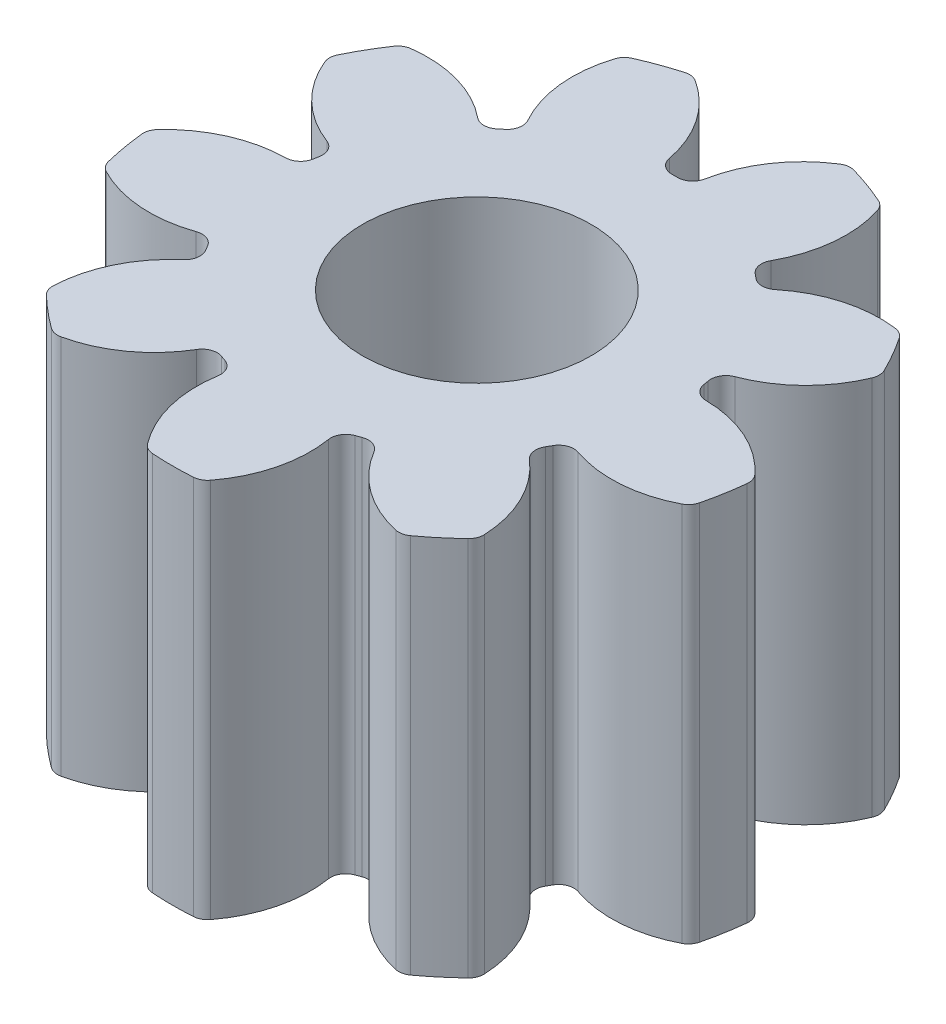
from build123d import *

# Parameters (mm, degrees)
SKETCH1_R           = 2
SKETCH1_R_2         = 0.75
BOSS_EXTRUDE1_DEPTH = 2.5
CUT_EXTRUDE1_DEPTH  = 4.774917218
CIRPATTERN1_COUNT   = 9
FILLET1_R           = 0.1


with BuildPart() as part:
    # Sketch1 → Boss-Extrude1 (new body)
    with BuildSketch(Plane(origin=(0, 0, 0), x_dir=(1, 0, 0), z_dir=(0, 1, 0))):
        with Locations(Location((0, 0, 0), (0, 0, 270))):
            Circle(SKETCH1_R)
        with Locations(Location((0, 0, 0), (0, 0, 270))):
            Circle(SKETCH1_R_2, mode=Mode.SUBTRACT)
    extrude(amount=BOSS_EXTRUDE1_DEPTH)

    # Sketch2 → Cut-Extrude1 (cut, through all)
    with BuildSketch(Plane(origin=(0, 2.5, 0), x_dir=(1, 0, 0), z_dir=(0, 1, 0))):
        with BuildLine():
            ThreePointArc((-0.514059225, 1.932807055), (-0.230170473, 1.665286706), (-0.105331991, 1.295725732))
            ThreePointArc((-0.105331991, 1.295725732), (0, 1.3), (0.105331991, 1.295725732))
            ThreePointArc((0.105331991, 1.295725732), (0.230170473, 1.665286706), (0.514059225, 1.932807055))
            ThreePointArc((0.514059225, 1.932807055), (0, 2), (-0.514059225, 1.932807055))
        make_face()
    cut_extrude1 = extrude(amount=-CUT_EXTRUDE1_DEPTH, mode=Mode.SUBTRACT)

    # CirPattern1: Cut-Extrude1 ×9 about axis
    cirpattern1_axis = Axis((0, 0, 0), (0, 1, 0))
    for i in range(1, CIRPATTERN1_COUNT):
        add(cut_extrude1.rotate(cirpattern1_axis, i * 360 / CIRPATTERN1_COUNT), mode=Mode.SUBTRACT)

    # Fillet1
    fillet1_edges = [part.edges().sort_by_distance(p)[0] for p in [
        (0.848592214, 1.25, -1.811047005),
        (1.63617664, 1.25, -1.150185204),
        (0.913565432, 1.25, -0.924877398),
        (0.75218746, 1.25, -1.060289595),
        (-0.514059225, 1.25, -1.932807055),
        (0.514059225, 1.25, -1.932807055),
        (0.105331991, 1.25, -1.295725732),
        (-0.105331991, 1.25, -1.295725732),
        (-0.178001286, 1.25, 1.992063137),
        (-1.144116607, 1.25, 1.640425917),
        (-0.542143995, 1.25, 1.181558246),
        (-0.344184606, 1.25, 1.253609571),
        (1.144116607, 1.25, 1.640425917),
        (0.178001286, 1.25, 1.992063137),
        (0.344184606, 1.25, 1.253609571),
        (0.542143995, 1.25, 1.181558246),
        (1.930889623, 1.25, 0.52121518),
        (1.416830398, 1.25, 1.411591876),
        (1.069465405, 1.25, 0.739083046),
        (1.174797395, 1.25, 0.556642686),
        (1.814177925, 1.25, -0.841877933),
        (1.992708821, 1.25, 0.170621088),
        (1.294331455, 1.25, -0.121268651),
        (1.257750038, 1.25, -0.328732173),
        (-1.416830398, 1.25, 1.411591876),
        (-1.930889623, 1.25, 0.52121518),
        (-1.174797395, 1.25, 0.556642686),
        (-1.069465405, 1.25, 0.739083046),
        (-1.992708821, 1.25, 0.170621088),
        (-1.814177925, 1.25, -0.841877933),
        (-1.257750038, 1.25, -0.328732173),
        (-1.294331455, 1.25, -0.121268651),
        (-1.63617664, 1.25, -1.150185204),
        (-0.848592214, 1.25, -1.811047005),
        (-0.75218746, 1.25, -1.060289595),
        (-0.913565432, 1.25, -0.924877398),
    ]]
    fillet(fillet1_edges, radius=FILLET1_R)


solid = part.part
